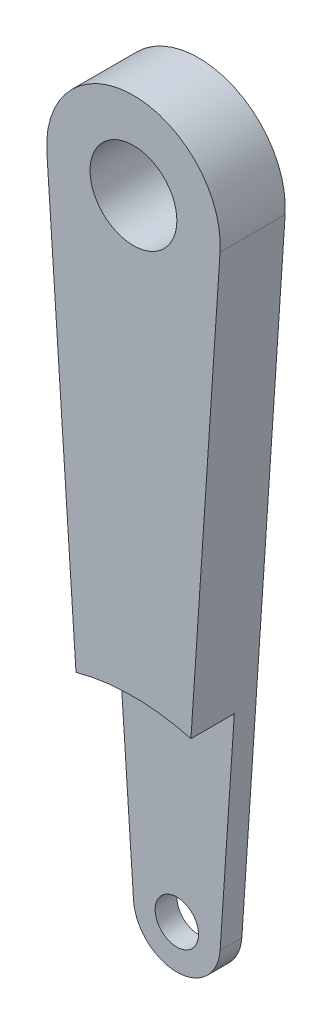
from build123d import *

# Parameters (mm, degrees)
SKETCH1_R           = 2
SKETCH1_R_2         = 1
BOSS_EXTRUDE1_DEPTH = 3
SKETCH2_R           = 10
CUT_EXTRUDE1_DEPTH  = 2


with BuildPart() as part:
    # Sketch1 → Boss-Extrude1 (new body)
    with BuildSketch(Plane.XY):
        with BuildLine():
            Line((1.995550606, 19.866666667), (3.991101213, 49.733333333))
            ThreePointArc((3.991101213, 49.733333333), (0, 54), (-3.991101213, 49.733333333))
            Line((-3.991101213, 49.733333333), (-1.995550606, 19.866666667))
            ThreePointArc((-1.995550606, 19.866666667), (0, 18), (1.995550606, 19.866666667))
        make_face()
        with Locations((0, 50)):
            Circle(SKETCH1_R, mode=Mode.SUBTRACT)
        with Locations((0, 20)):
            Circle(SKETCH1_R_2, mode=Mode.SUBTRACT)
    extrude(amount=BOSS_EXTRUDE1_DEPTH)

    # Sketch2 → Cut-Extrude1 (cut)
    with BuildSketch(Plane.XY.offset(3)):
        with Locations((0, 20)):
            Circle(SKETCH2_R)
    extrude(amount=-CUT_EXTRUDE1_DEPTH, mode=Mode.SUBTRACT)


solid = part.part
